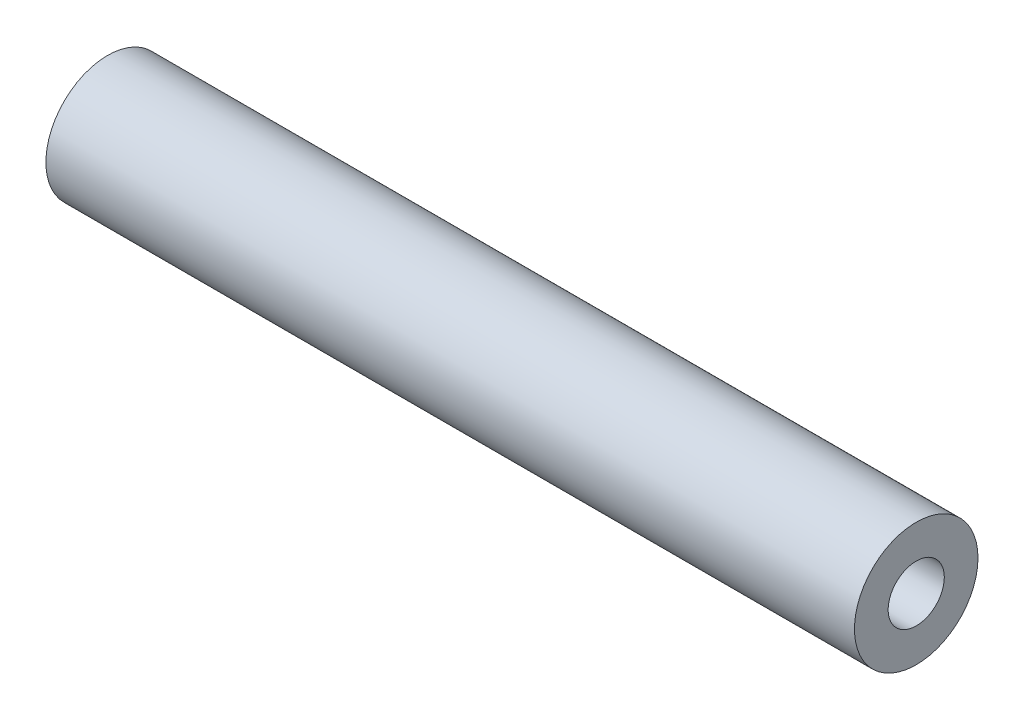
from build123d import *

# Parameters (mm, degrees)
SKETCH2_R           = 3.4925
SKETCH2_R_2         = 1.5875
BOSS_EXTRUDE1_DEPTH = 45.72


with BuildPart() as part:
    # Sketch2 → Boss-Extrude1 (new body)
    with BuildSketch(Plane(origin=(0, 0, 0), x_dir=(0, 0, -1), z_dir=(1, 0, 0))):
        Circle(SKETCH2_R)
        Circle(SKETCH2_R_2, mode=Mode.SUBTRACT)
    extrude(amount=BOSS_EXTRUDE1_DEPTH)


solid = part.part
